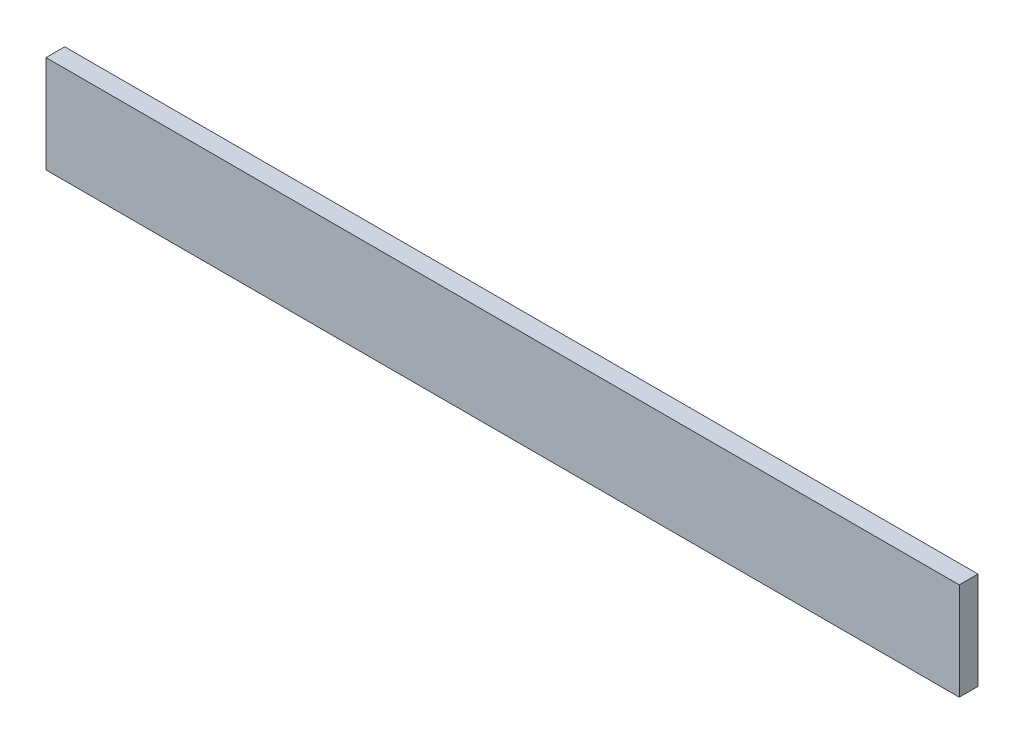
from build123d import *

# Parameters (mm, degrees)
SKETCH_1_W      = 2440
SKETCH_1_H      = 260
EXTRUDE_1_DEPTH = 50


with BuildPart() as part:
    # Эскиз1 → Бобышка-Вытянуть1 (new body)
    with BuildSketch(Plane.XY):
        with Locations((1220, 130)):
            Rectangle(SKETCH_1_W, SKETCH_1_H)
    extrude(amount=EXTRUDE_1_DEPTH)


solid = part.part
